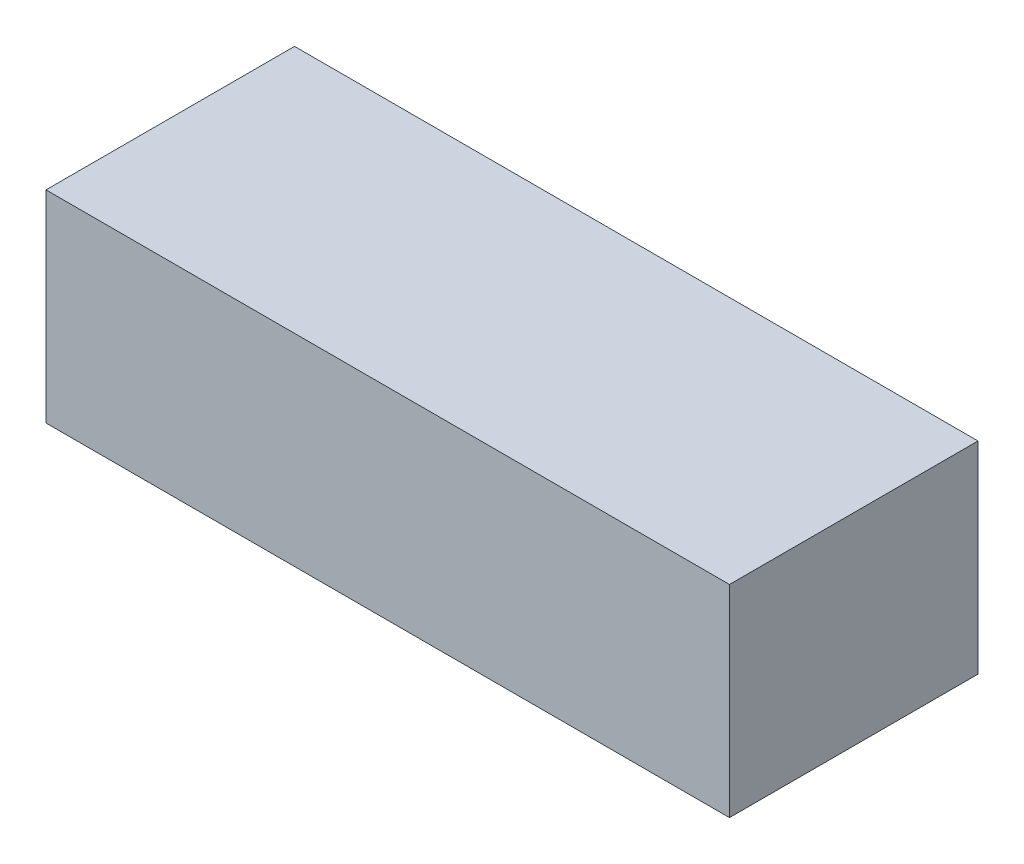
from build123d import *

# Parameters (mm, degrees)
SKETCH_1_W          = 44
SKETCH_1_H          = 16
EXTRUDE_1_DEPTH     = 2
SKETCH_2_W          = 44
SKETCH_2_H          = 16
SKETCH_2_W_2        = 40
SKETCH_2_H_2        = 12
EXTRUDE_2_DEPTH     = 10
SKETCH_3_W          = 5.5
SKETCH_3_H          = 4
CUT_EXTRUDE_1_DEPTH = 2
SKETCH_4_W          = 1.7
SKETCH_4_H          = 12
EXTRUDE_4_DEPTH     = 4.6
SKETCH_9_W          = 44
SKETCH_9_H          = 16
SKETCH_9_W_2        = 42
SKETCH_9_H_2        = 14
EXTRUDE_5_DEPTH     = 1
SKETCH_12_W         = 1
SKETCH_12_H         = 12
CUT_EXTRUDE_3_DEPTH = 5


with BuildPart() as part:
    # 草图1 → 凸台-拉伸1 (new body)
    with BuildSketch(Plane(origin=(0, 0, 0), x_dir=(1, 0, 0), z_dir=(0, 1, 0))):
        Rectangle(SKETCH_1_W, SKETCH_1_H)
    extrude(amount=-EXTRUDE_1_DEPTH)

    # 草图2 → 凸台-拉伸2 (add)
    with BuildSketch(Plane.XZ.offset(2)):
        Rectangle(SKETCH_2_W, SKETCH_2_H)
        Rectangle(SKETCH_2_W_2, SKETCH_2_H_2, mode=Mode.SUBTRACT)
    extrude(amount=EXTRUDE_2_DEPTH)

    # 草图3 → 切除-拉伸1 (cut)
    with BuildSketch(Plane.ZY.offset(22)):
        with Locations((2.75, -9)):
            Rectangle(SKETCH_3_W, SKETCH_3_H)
        with Locations((-2.75, -9)):
            Rectangle(SKETCH_3_W, SKETCH_3_H)
    extrude(amount=-CUT_EXTRUDE_1_DEPTH, mode=Mode.SUBTRACT)

    # 草图4 → 凸台-拉伸4 (add)
    with BuildSketch(Plane.XZ.offset(2)):
        with Locations((7.15, 0)):
            Rectangle(SKETCH_4_W, SKETCH_4_H)
        with Locations((-19.15, 0)):
            Rectangle(SKETCH_4_W, SKETCH_4_H)
        with Locations((-6, 0)):
            Rectangle(SKETCH_4_W, SKETCH_4_H)
    extrude(amount=EXTRUDE_4_DEPTH)

    # 草图9 → 凸台-拉伸5 (add)
    with BuildSketch(Plane.XZ.offset(12)):
        Rectangle(SKETCH_9_W, SKETCH_9_H)
        Rectangle(SKETCH_9_W_2, SKETCH_9_H_2, mode=Mode.SUBTRACT)
    extrude(amount=EXTRUDE_5_DEPTH)

    # 草图12 → 切除-拉伸3 (cut)
    with BuildSketch(Plane.XZ.offset(12)):
        with Locations((20.5, 0)):
            Rectangle(SKETCH_12_W, SKETCH_12_H)
    extrude(amount=-CUT_EXTRUDE_3_DEPTH, mode=Mode.SUBTRACT)


solid = part.part
